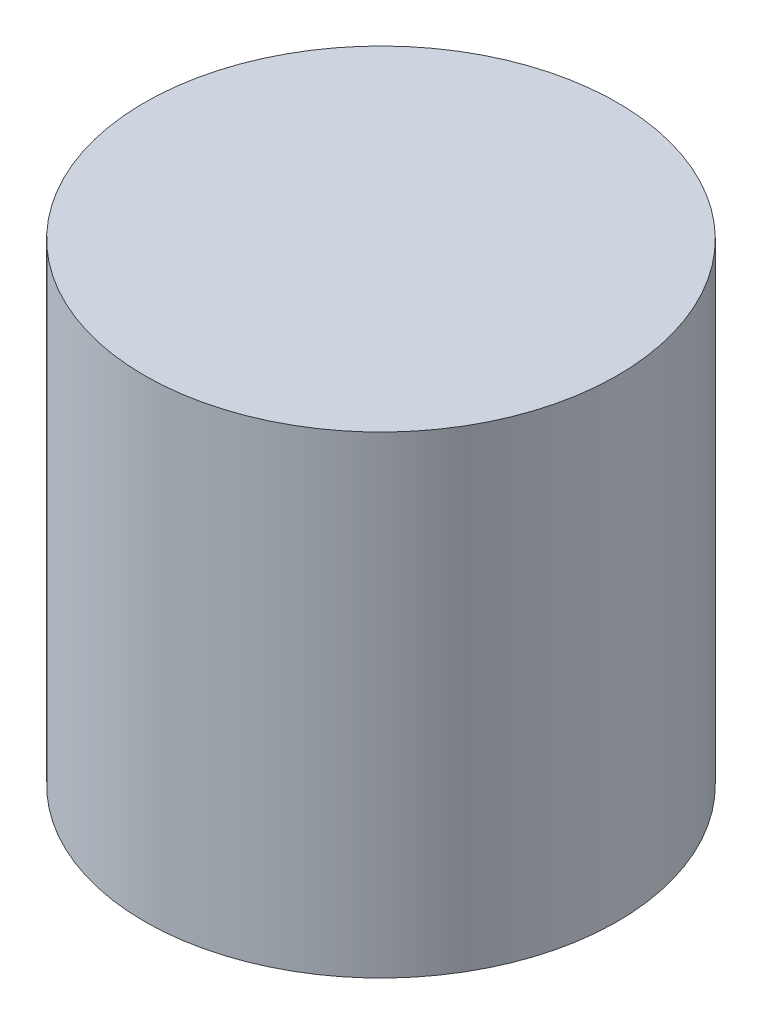
from build123d import *

# Parameters (mm, degrees)
SKETCH1_R           = 3.1242
BOSS_EXTRUDE1_DEPTH = 6.2484


with BuildPart() as part:
    # Sketch1 → Boss-Extrude1 (new body)
    with BuildSketch(Plane(origin=(0, 0, 0), x_dir=(1, 0, 0), z_dir=(0, 1, 0))):
        with Locations(Location((0, 0, 0), (0, 0, 270))):
            Circle(SKETCH1_R)
    extrude(amount=BOSS_EXTRUDE1_DEPTH)


solid = part.part
